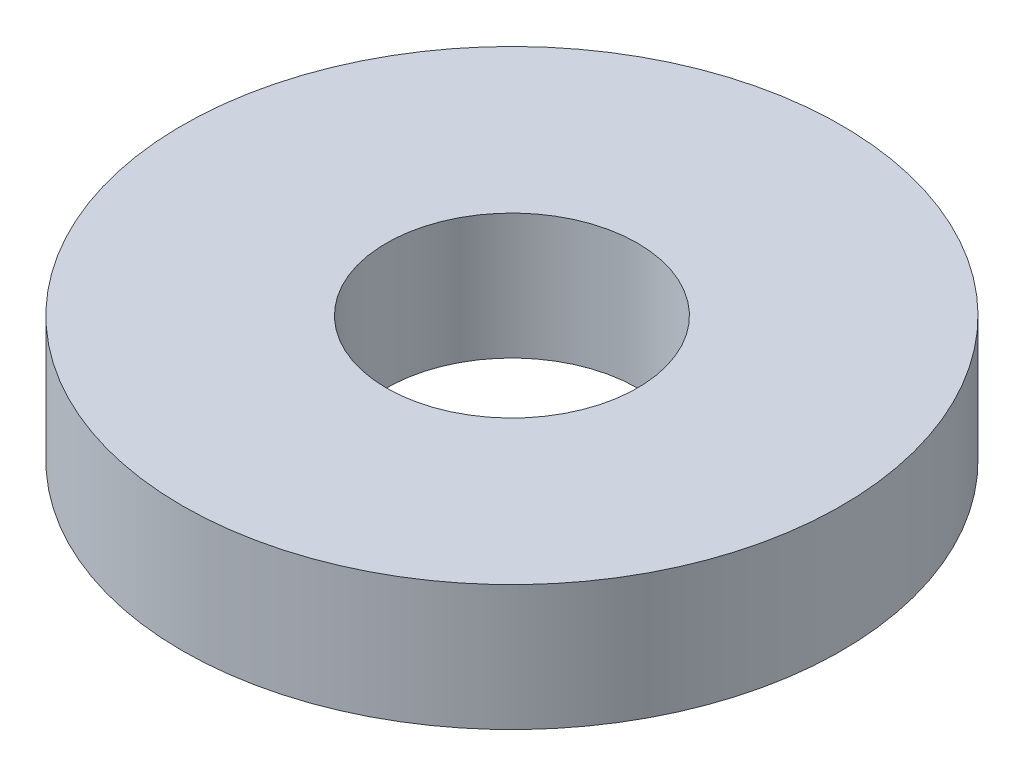
from build123d import *

# Parameters (mm, degrees)
SKETCH_1_R      = 10.5
SKETCH_1_R_2    = 4
EXTRUDE_1_DEPTH = 4


with BuildPart() as part:
    # 草图1 → 凸台-拉伸1 (new body)
    with BuildSketch(Plane(origin=(0, 0, 0), x_dir=(1, 0, 0), z_dir=(0, 1, 0))):
        with Locations(Location((0, 0, 0), (0, 0, 270))):
            Circle(SKETCH_1_R)
        with Locations(Location((0, 0, 0), (0, 0, 270))):
            Circle(SKETCH_1_R_2, mode=Mode.SUBTRACT)
    extrude(amount=EXTRUDE_1_DEPTH)


solid = part.part
